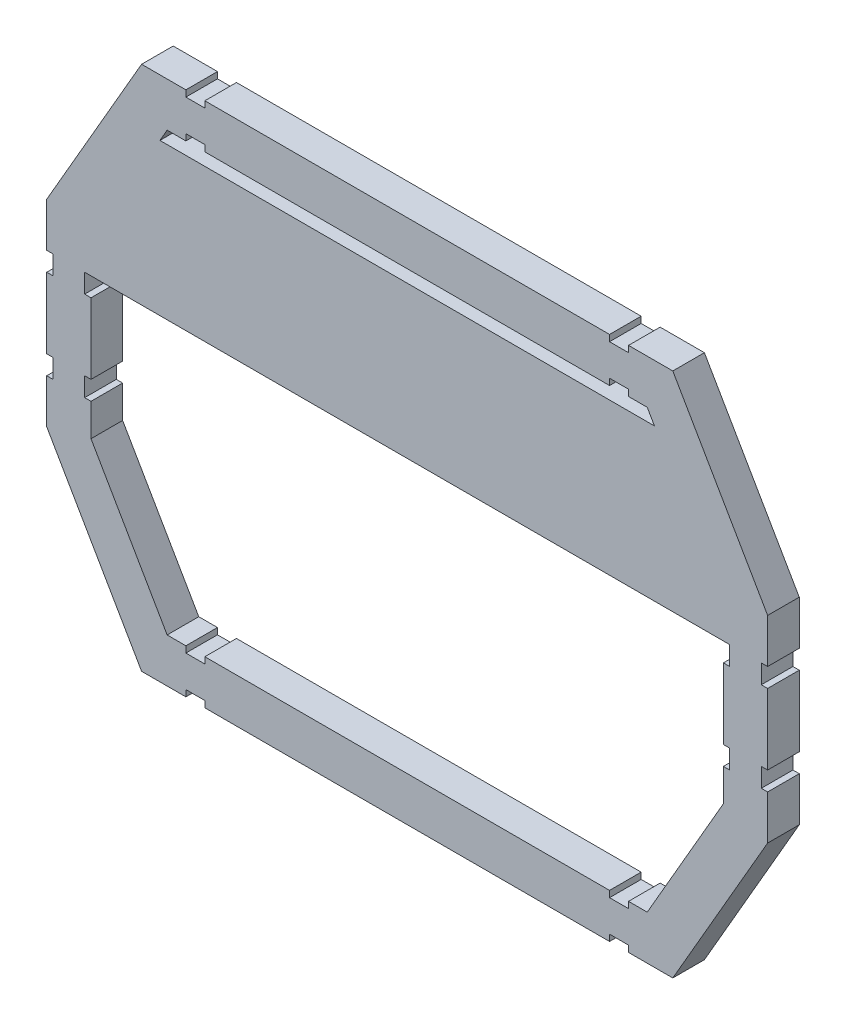
from build123d import *

# Parameters (mm, degrees)
BOSS_EXTRU_1_DEPTH = 5


with BuildPart() as part:
    # Esquisse1 → Boss.-Extru.1 (new body)
    with BuildSketch(Plane.XY):
        Polygon((82.539833849, -153.626771729), (18.539833849, -153.626771729), (18.539833849, -152.626771729), (15.539833849, -152.626771729), (15.539833849, -153.626771729), (8.539833849, -153.626771729), (-6.460166151, -127.646009615), (-6.460166151, -120.646009615), (-5.460166151, -120.646009615), (-5.460166151, -117.646009615), (-6.460166151, -117.646009615), (-6.460166151, -106.469095079), (-5.460166151, -106.469095079), (-5.460166151, -103.469095079), (-6.460166151, -103.469095079), (-6.460166151, -96.469095079), (8.539833849, -70.488332966), (15.539833849, -70.488332966), (15.539833849, -71.488332966), (18.539833849, -71.488332966), (18.539833849, -70.488332966), (82.539833849, -70.488332966), (82.539833849, -71.488332966), (85.539833849, -71.488332966), (85.539833849, -70.488332966), (92.539833849, -70.488332965), (107.539833849, -96.469095079), (107.539833849, -103.469095079), (106.539833849, -103.469095079), (106.539833849, -106.469095079), (107.539833849, -106.469095079), (107.539833849, -117.646009615), (106.539833849, -117.646009615), (106.539833849, -120.646009615), (107.539833849, -120.646009615), (107.539833849, -127.646009615), (92.539833849, -153.626771729), (85.539833849, -153.626771729), (85.539833849, -152.626771729), (82.539833849, -152.626771729), align=None)
        Polygon((0.539833849, -106.469095079), (0.539833849, -117.646009615), (-0.460166151, -117.646009615), (-0.460166151, -120.646009615), (0.539833849, -120.646009615), (0.539833849, -125.770365268), (12.581285733, -146.626771729), (15.539833849, -146.626771729), (15.539833849, -147.626771729), (18.539833849, -147.626771729), (18.539833849, -146.626771729), (82.539833849, -146.626771729), (82.539833849, -147.626771729), (85.539833849, -147.626771729), (85.539833849, -146.626771729), (88.498381965, -146.626771729), (100.539833849, -125.770365268), (100.539833849, -120.646009615), (101.539833849, -120.646009615), (101.539833849, -117.646009615), (100.539833849, -117.646009615), (100.539833849, -106.469095079), (101.539833849, -106.469095079), (101.539833849, -103.469095079), (100.539833849, -103.469095079), (0.539833849, -103.469095079), (-0.460166151, -103.469095079), (-0.460166151, -106.469095079), align=None, mode=Mode.SUBTRACT)
        Polygon((18.539833849, -77.488332966), (82.539833849, -77.488332966), (82.539833849, -76.488332966), (85.539833849, -76.488332966), (85.539833849, -77.488332966), (88.498381965, -77.488332966), (89.641975504, -79.469095079), (11.437692194, -79.469095079), (12.581285733, -77.488332966), (15.539833849, -77.488332966), (15.539833849, -76.488332966), (18.539833849, -76.488332966), align=None, mode=Mode.SUBTRACT)
    extrude(amount=BOSS_EXTRU_1_DEPTH)


solid = part.part
